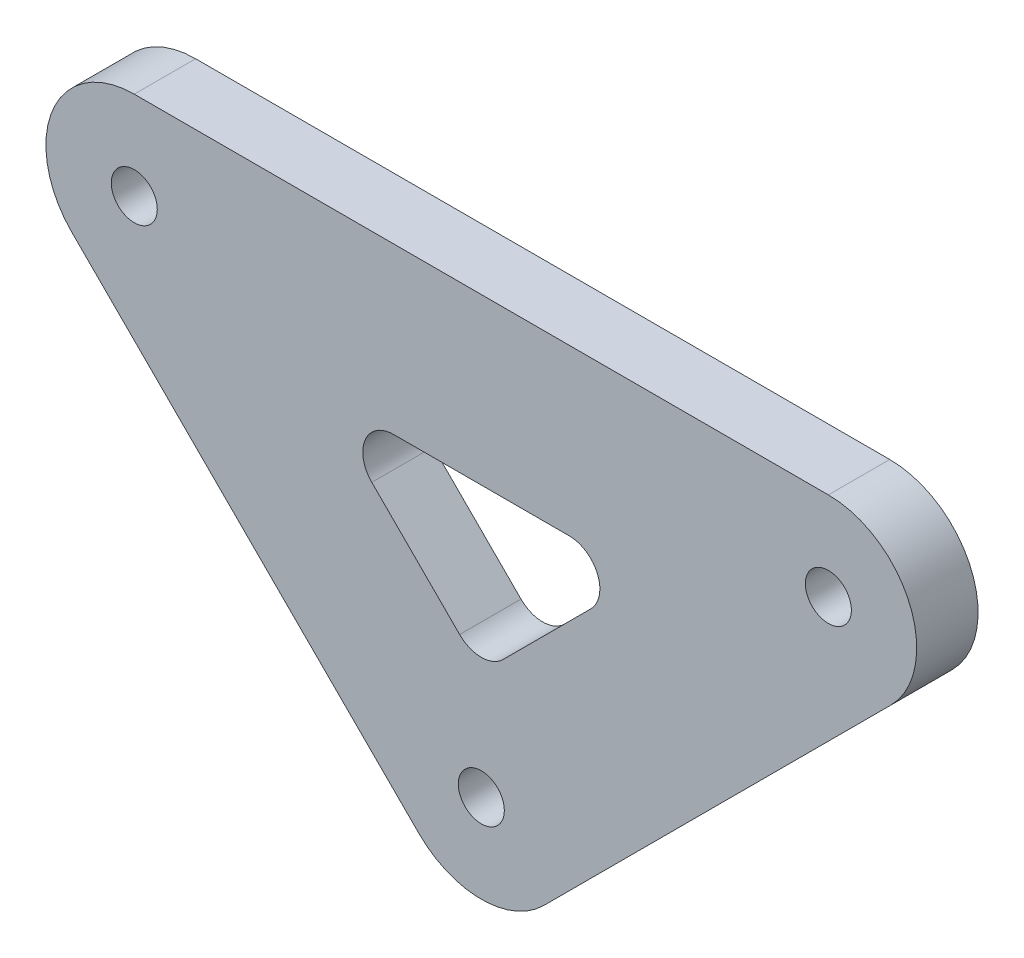
from build123d import *

# Parameters (mm, degrees)
SCHIZZO1_R                   = 1.5
ESTRUSIONE_ESTRUSIONE1_DEPTH = 4


with BuildPart() as part:
    # Schizzo1 → Estrusione-Estrusione1 (new body)
    with BuildSketch(Plane.XY):
        with BuildLine():
            Line((22.627416998, 28.387976608), (-22.627416998, 28.387976608))
            ThreePointArc((-22.627416998, 28.387976608), (-27.949480117, 24.831887722), (-26.700747761, 18.554086235))
            Line((-26.700747761, 18.554086235), (-4.073330763, -4.073330763))
            ThreePointArc((-4.073330763, -4.073330763), (0, -5.76055961), (4.073330763, -4.073330763))
            Line((4.073330763, -4.073330763), (26.700747761, 18.554086235))
            ThreePointArc((26.700747761, 18.554086235), (27.949480117, 24.831887722), (22.627416998, 28.387976608))
        make_face()
        Circle(SCHIZZO1_R, mode=Mode.SUBTRACT)
        with Locations((22.627416998, 22.627416998)):
            Circle(SCHIZZO1_R, mode=Mode.SUBTRACT)
        with Locations((-22.627416998, 22.627416998)):
            Circle(SCHIZZO1_R, mode=Mode.SUBTRACT)
        with BuildLine():
            Line((5.727922061, 17.627416998), (-5.727922061, 17.627416998))
            ThreePointArc((-5.727922061, 17.627416998), (-7.575681126, 16.392783863), (-7.142135624, 14.213203436))
            Line((-7.142135624, 14.213203436), (-1.414213562, 8.485281374))
            ThreePointArc((-1.414213562, 8.485281374), (0, 7.899494937), (1.414213562, 8.485281374))
            Line((1.414213562, 8.485281374), (7.142135624, 14.213203436))
            ThreePointArc((7.142135624, 14.213203436), (7.575681126, 16.392783863), (5.727922061, 17.627416998))
        make_face(mode=Mode.SUBTRACT)
    extrude(amount=ESTRUSIONE_ESTRUSIONE1_DEPTH)


solid = part.part
